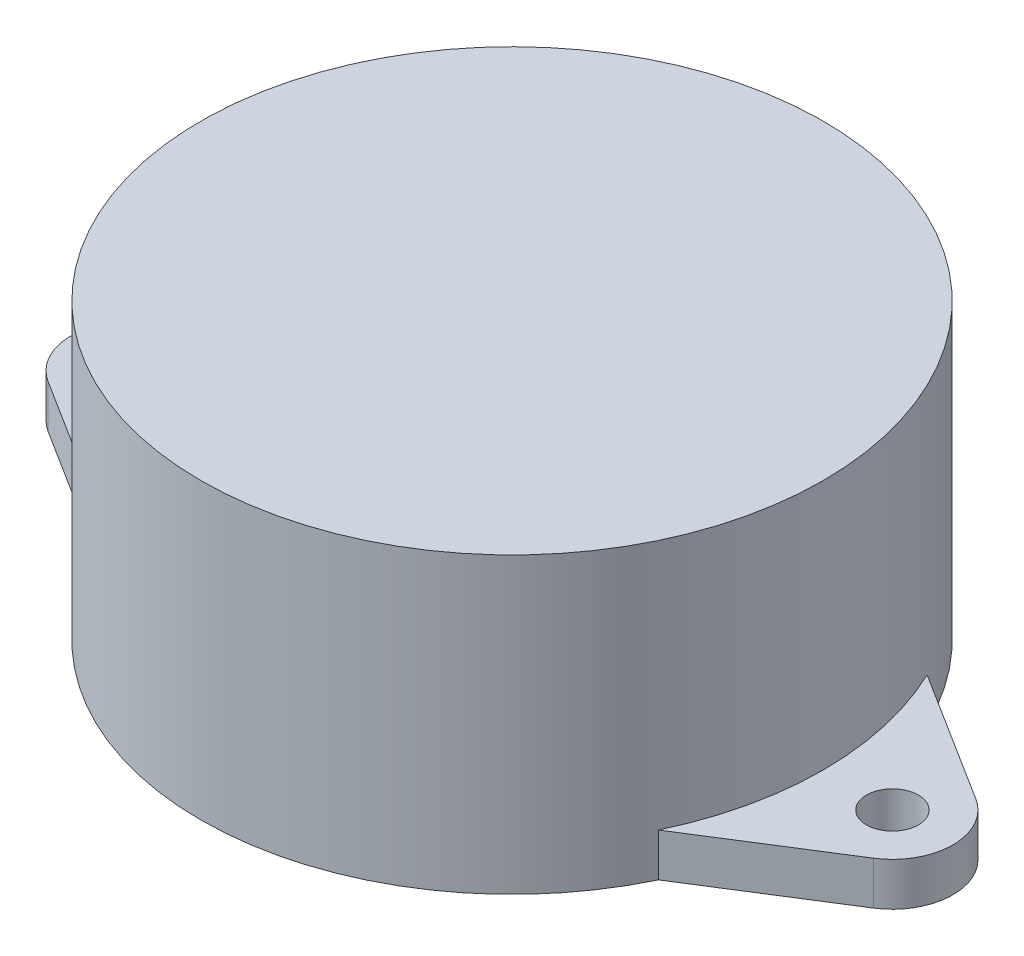
from build123d import *

# Parameters (mm, degrees)
SKETCH1_R           = 1.5
BOSS_EXTRUDE1_DEPTH = 2.5
BOSS_EXTRUDE2_START = -2.5
SKETCH2_R           = 18
BOSS_EXTRUDE2_DEPTH = 17
SKETCH3_R           = 8
BOSS_EXTRUDE3_DEPTH = 1.8
SKETCH4_R           = 2.5
BOSS_EXTRUDE4_DEPTH = 5


with BuildPart() as part:
    # Sketch1 → Boss-Extrude1 (new body)
    with BuildSketch(Plane(origin=(0, 0, 0), x_dir=(1, 0, 0), z_dir=(0, 1, 0))):
        with BuildLine():
            Line((-16.237503877, 7.768105807), (-23.86592771, 2.961133868))
            ThreePointArc((-23.86592771, 2.961133868), (-25.5, 0), (-23.86592771, -2.961133868))
            Line((-23.86592771, -2.961133868), (-16.237503877, -7.768105807))
            ThreePointArc((-16.237503877, -7.768105807), (0, -18), (16.237503877, -7.768105807))
            Line((16.237503877, -7.768105807), (23.86592771, -2.961133868))
            ThreePointArc((23.86592771, -2.961133868), (25.5, 0), (23.86592771, 2.961133868))
            Line((23.86592771, 2.961133868), (16.237503877, 7.768105807))
            ThreePointArc((16.237503877, 7.768105807), (0, 18), (-16.237503877, 7.768105807))
        make_face()
        with Locations(Location((-22, 0, 0), (0, 0, 270))):
            Circle(SKETCH1_R, mode=Mode.SUBTRACT)
        with Locations(Location((22, 0, 0), (0, 0, 90))):
            Circle(SKETCH1_R, mode=Mode.SUBTRACT)
    extrude(amount=BOSS_EXTRUDE1_DEPTH)

    # Sketch2 → Boss-Extrude2 (add)
    with BuildSketch(Plane(origin=(0, 2.5, 0), x_dir=(1, 0, 0), z_dir=(0, 1, 0)).offset(BOSS_EXTRUDE2_START)):
        with Locations(Location((0, 0, 0), (0, 0, 25.566693529))):
            Circle(SKETCH2_R)
    extrude(amount=BOSS_EXTRUDE2_DEPTH)

    # Sketch3 → Boss-Extrude3 (add)
    with BuildSketch(Plane.XZ):
        with Locations(Location((0, 0, 0), (0, 0, 270))):
            Circle(SKETCH3_R)
    extrude(amount=BOSS_EXTRUDE3_DEPTH)

    # Sketch4 → Boss-Extrude4 (add)
    with BuildSketch(Plane.XZ.offset(1.8)):
        with Locations(Location((0, 0, 0), (0, 0, 270))):
            Circle(SKETCH4_R)
    extrude(amount=BOSS_EXTRUDE4_DEPTH)


solid = part.part
